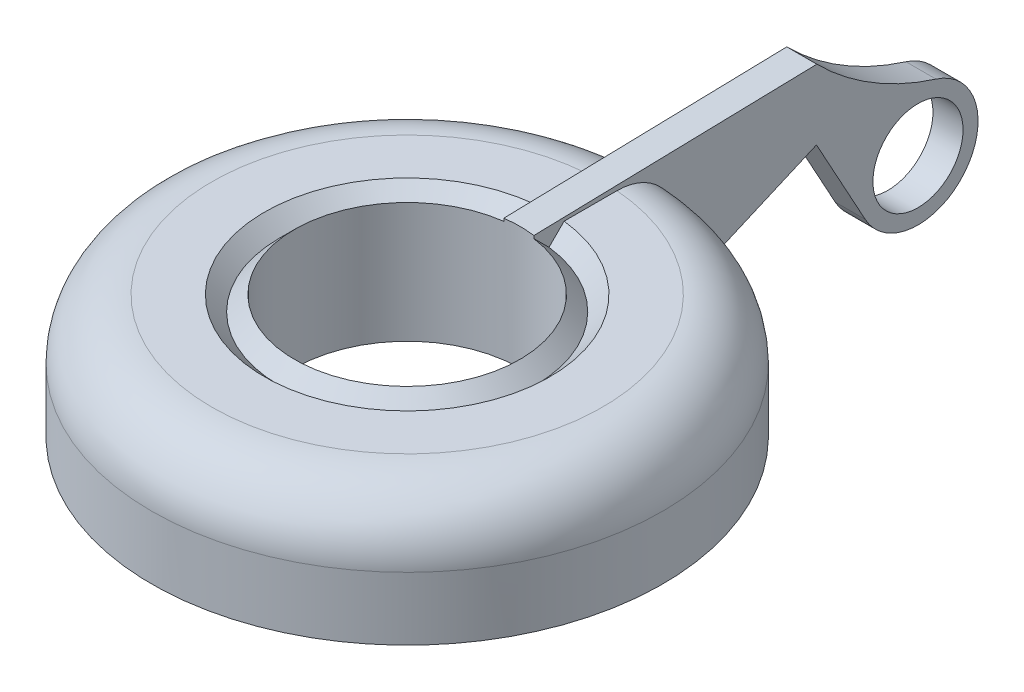
from build123d import *

# Parameters (mm, degrees)
FILLET1_R                = 2
SKETCH5_R                = 8.5
SKETCH5_R_2              = 7
BOSS_EXTRUDE1_DEPTH      = 0.1
BOSS_EXTRUDE2_DEPTH      = 0.5
BOSS_EXTRUDE2_DEPTH_BACK = 0.5
SKETCH6_R                = 1.5
CUT_EXTRUDE1_DEPTH       = 22.224985432
CUT_EXTRUDE1_DEPTH_BACK  = 22.224985432
SKETCH7_R                = 3.75


with BuildPart() as part:
    # Sketch4 → Revolve1 (revolve)
    with BuildSketch(Plane(origin=(0, 0, 0), x_dir=(0, 0, -1), z_dir=(1, 0, 0))):
        Polygon((0, 0), (-3.75, 0), (-4.25, -0.5), (-4.75, 0), (-8.5, 0), (-8.5, -4), (0, -4), align=None)
    revolve(axis=Axis((0, 1.890471386, 0), (0, -1, 0)))

    # Fillet1
    fillet1_edges = [part.edges().sort_by_distance(p)[0] for p in [
        (0, 0, -8.5),
    ]]
    fillet(fillet1_edges, radius=FILLET1_R)



with BuildPart() as body_2:
    # Sketch5 → Boss-Extrude1 (new body)
    with BuildSketch(Plane.XZ.offset(4)):
        Circle(SKETCH5_R)
        Circle(SKETCH5_R_2, mode=Mode.SUBTRACT)
    extrude(amount=BOSS_EXTRUDE1_DEPTH)


with BuildPart() as part_1:
    add(part.part)

    add(body_2.part)  # Boss-Extrude2 merges body 2
    # Sketch6 → Boss-Extrude2 (add, two sides: drawn at the far end of the back side and taken through both)
    with BuildSketch(Plane(origin=(0, 0, 0), x_dir=(0, 0, -1), z_dir=(1, 0, 0)).offset(-BOSS_EXTRUDE2_DEPTH_BACK)):
        with BuildLine():
            Line((13.132863069, 0.320027848), (0, 0))
            Line((0, 0), (0, -0.907670556))
            Line((0, -0.907670556), (7.174444166, -0.907670556))
            Line((7.174444166, -0.907670556), (8.5, -4))
            Line((8.5, -4), (13.12184584, -1.999779955))
            Line((13.12184584, -1.999779955), (14.746442499, -4.961787965))
            ThreePointArc((14.746442499, -4.961787965), (18.046890478, -5.267726252), (17.098589091, -2.09167846))
            ThreePointArc((17.098589091, -2.09167846), (14.968839585, -1.127360353), (13.132863069, 0.320027848))
        make_face()
        with Locations((16.5, -4)):
            Circle(SKETCH6_R, mode=Mode.SUBTRACT)
    extrude(amount=BOSS_EXTRUDE2_DEPTH + BOSS_EXTRUDE2_DEPTH_BACK)

    # Sketch7 → Cut-Extrude1 (cut, two sides: drawn at the far end of the back side and taken through both)
    with BuildSketch(Plane(origin=(0, 0, 0), x_dir=(1, 0, 0), z_dir=(0, 1, 0)).offset(-CUT_EXTRUDE1_DEPTH_BACK)):
        Circle(SKETCH7_R)
    extrude(amount=CUT_EXTRUDE1_DEPTH + CUT_EXTRUDE1_DEPTH_BACK, mode=Mode.SUBTRACT)


solid = part_1.part
